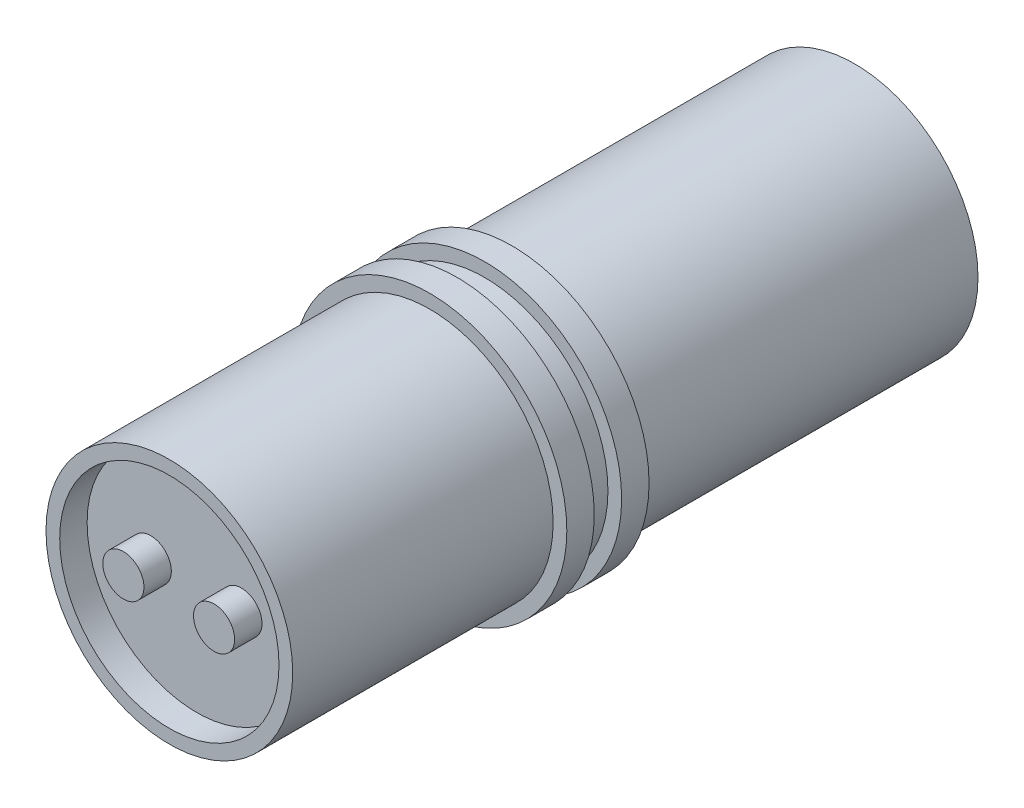
from build123d import *

# Parameters (mm, degrees)
SKETCH1_R           = 9
BOSS_EXTRUDE1_DEPTH = 25
SKETCH3_R           = 10
BOSS_EXTRUDE2_DEPTH = 2
SKETCH4_R           = 9
BOSS_EXTRUDE3_DEPTH = 2
SKETCH5_R           = 10
BOSS_EXTRUDE4_DEPTH = 2
SKETCH6_R           = 9
BOSS_EXTRUDE5_DEPTH = 19
SKETCH7_R           = 8
CUT_EXTRUDE1_DEPTH  = 2
SKETCH8_R           = 1.5
BOSS_EXTRUDE6_DEPTH = 2
BOSS_EXTRUDE7_DEPTH = 2


with BuildPart() as part:
    # Sketch1 → Boss-Extrude1 (new body)
    with BuildSketch(Plane.XY):
        Circle(SKETCH1_R)
    extrude(amount=BOSS_EXTRUDE1_DEPTH)

    # Sketch3 → Boss-Extrude2 (add)
    with BuildSketch(Plane.XY.offset(25)):
        Circle(SKETCH3_R)
    extrude(amount=BOSS_EXTRUDE2_DEPTH)

    # Sketch4 → Boss-Extrude3 (add)
    with BuildSketch(Plane.XY.offset(27)):
        Circle(SKETCH4_R)
    extrude(amount=BOSS_EXTRUDE3_DEPTH)

    # Sketch5 → Boss-Extrude4 (add)
    with BuildSketch(Plane.XY.offset(29)):
        Circle(SKETCH5_R)
    extrude(amount=BOSS_EXTRUDE4_DEPTH)

    # Sketch6 → Boss-Extrude5 (add)
    with BuildSketch(Plane.XY.offset(31)):
        Circle(SKETCH6_R)
    extrude(amount=BOSS_EXTRUDE5_DEPTH)

    # Sketch7 → Cut-Extrude1 (cut)
    with BuildSketch(Plane.XY.offset(50)):
        Circle(SKETCH7_R)
    extrude(amount=-CUT_EXTRUDE1_DEPTH, mode=Mode.SUBTRACT)

    # Sketch8 → Boss-Extrude6 (add)
    with BuildSketch(Plane.XY.offset(48)):
        with Locations((-3.354571174, 0)):
            Circle(SKETCH8_R)
        with Locations((3.262554329, 0)):
            Circle(SKETCH8_R)
    extrude(amount=BOSS_EXTRUDE6_DEPTH)

    # Sketch9 → Boss-Extrude7 (add)
    with BuildSketch(Plane(origin=(0, 0, 0), x_dir=(-1, 0, 0), z_dir=(0, 0, -1))):
        with BuildLine():
            Line((2.630574057, 5.182535367), (6.058172796, 0.703309821))
            ThreePointArc((6.058172796, 0.703309821), (5.842389235, -0.919093383), (4.219986031, -0.703309821))
            Line((4.219986031, -0.703309821), (0.792387292, 3.775915724))
            ThreePointArc((0.792387292, 3.775915724), (1.008170853, 5.398318928), (2.630574057, 5.182535367))
        make_face()
    extrude(amount=BOSS_EXTRUDE7_DEPTH)


solid = part.part
